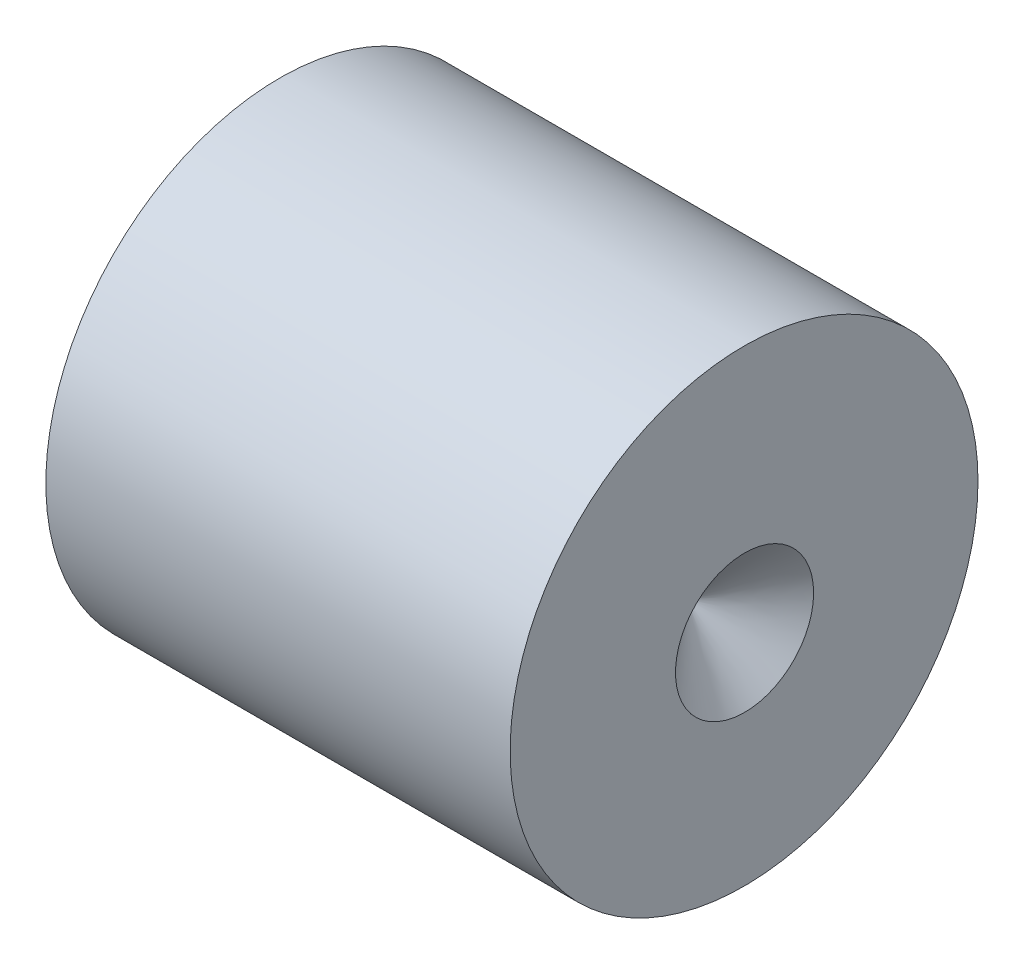
from build123d import *

# Parameters (mm, degrees)
SKETCH1_R                              = 5.119071812
BOSS_EXTRUDE1_DEPTH                    = 10.16
F_97_0_0059_DIAMETER_HOLE1_D           = 0.14986
F_97_0_0059_DIAMETER_HOLE1_DEPTH       = 4.064
F_97_0_0059_DIAMETER_HOLE1_CSINK_D     = 3.0226
F_97_0_0059_DIAMETER_HOLE1_CSINK_ANGLE = 100
F_97_0_0059_DIAMETER_HOLE1_TIP         = 0.045022486
F_97_0_0059_DIAMETER_HOLE2_D           = 0.14986
F_97_0_0059_DIAMETER_HOLE2_DEPTH       = 4.064
F_97_0_0059_DIAMETER_HOLE2_CSINK_D     = 3.0226
F_97_0_0059_DIAMETER_HOLE2_CSINK_ANGLE = 100
F_97_0_0059_DIAMETER_HOLE2_TIP         = 0.045022486


with BuildPart() as part:
    # Sketch1 → Boss-Extrude1 (new body)
    with BuildSketch(Plane(origin=(0, 0, 0), x_dir=(0, 0, -1), z_dir=(1, 0, 0))):
        with Locations((-7.977955169, 45.822101484)):
            Circle(SKETCH1_R)
    extrude(amount=BOSS_EXTRUDE1_DEPTH)

    # #97 (0.0059) Diameter Hole1
    with Locations(Plane(origin=(10.16, 0, 0), x_dir=(0, 0, -1), z_dir=(1, 0, 0))):
        with Locations((-7.966953198, 45.502352874), (-8.184469296, 76.052039223), (-8.264751999, 76.50814273)):
            CounterSinkHole(F_97_0_0059_DIAMETER_HOLE1_D / 2, F_97_0_0059_DIAMETER_HOLE1_CSINK_D / 2, depth=F_97_0_0059_DIAMETER_HOLE1_DEPTH, counter_sink_angle=F_97_0_0059_DIAMETER_HOLE1_CSINK_ANGLE)
            with Locations((0, 0, -(F_97_0_0059_DIAMETER_HOLE1_DEPTH + F_97_0_0059_DIAMETER_HOLE1_TIP / 2))):  # 118° drill point
                Cone(0, F_97_0_0059_DIAMETER_HOLE1_D / 2, F_97_0_0059_DIAMETER_HOLE1_TIP, mode=Mode.SUBTRACT)

    # #97 (0.0059) Diameter Hole2
    with Locations(Plane.ZY):
        with Locations((8.054455303, 45.605487912), (7.835684071, 14.98353801)):
            CounterSinkHole(F_97_0_0059_DIAMETER_HOLE2_D / 2, F_97_0_0059_DIAMETER_HOLE2_CSINK_D / 2, depth=F_97_0_0059_DIAMETER_HOLE2_DEPTH, counter_sink_angle=F_97_0_0059_DIAMETER_HOLE2_CSINK_ANGLE)
            with Locations((0, 0, -(F_97_0_0059_DIAMETER_HOLE2_DEPTH + F_97_0_0059_DIAMETER_HOLE2_TIP / 2))):  # 118° drill point
                Cone(0, F_97_0_0059_DIAMETER_HOLE2_D / 2, F_97_0_0059_DIAMETER_HOLE2_TIP, mode=Mode.SUBTRACT)


solid = part.part
